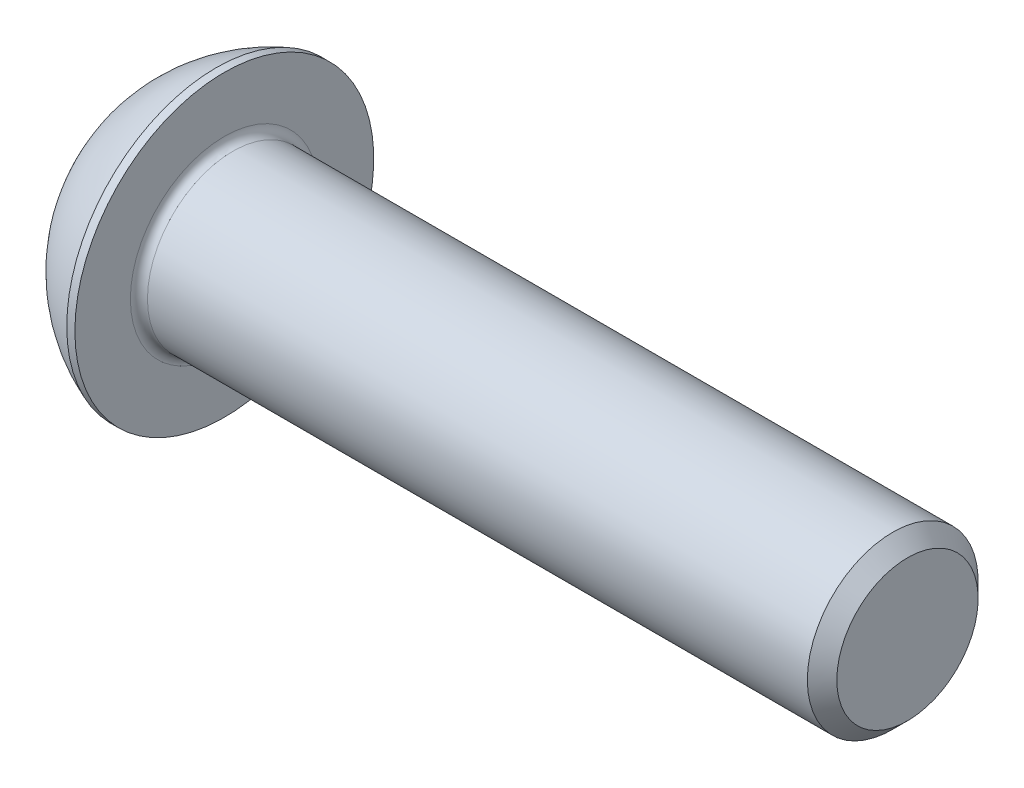
from build123d import *

# Parameters (mm, degrees)
FILLET1_R   = 0.4
HEX_2_DEPTH = 2.6


with BuildPart() as part:
    # BodySke → BaseBody (revolve)
    with BuildSketch(Plane.XY, mode=Mode.PRIVATE) as basebody_sk:
        with BuildLine():
            Line((36.4, 0), (36.4, 3.3095))
            Line((36.4, 3.3095), (35.7095, 4))
            Line((35.7095, 4), (4.4, 4))
            Line((4.4, 4), (4.4, 7))
            Line((4.4, 7), (4.02, 7))
            ThreePointArc((4.02, 7), (1.686451133, 5.621618984), (0, 3.5))
            Line((0, 3.5), (0, 0))
            Line((0, 0), (36.4, 0))
        make_face()
    revolve(basebody_sk.sketch.rotate(Axis((0, 0, 0), (1, 0, 0)), 90), axis=Axis((0, 0, 0), (1, 0, 0)))

    # Fillet1
    fillet1_edges = [part.edges().sort_by_distance(p)[0] for p in [
        (4.4, 0, -4),
    ]]
    fillet(fillet1_edges, radius=FILLET1_R)

    # Sketch2 → PreBroach (revolve, cut)
    with BuildSketch(Plane.XY, mode=Mode.PRIVATE) as prebroach_sk:
        Polygon((0, 2.5), (2.6, 2.5), (4.043375673, 0), (0, 0), align=None)
    revolve(prebroach_sk.sketch.rotate(Axis((0, 0, 0), (1, 0, 0)), 90), axis=Axis((0, 0, 0), (1, 0, 0)), mode=Mode.SUBTRACT)

    # Sketch3 → Hex 2 (cut)
    with BuildSketch(Plane(origin=(0, 0, 0), x_dir=(0, 0, -1), z_dir=(1, 0, 0))):
        Polygon((-2.5, -1.443375673), (-2.5, 1.443375673), (0, 2.886751346), (2.5, 1.443375673), (2.5, -1.443375673), (0, -2.886751346), align=None)
    extrude(amount=HEX_2_DEPTH, mode=Mode.SUBTRACT)


solid = part.part
